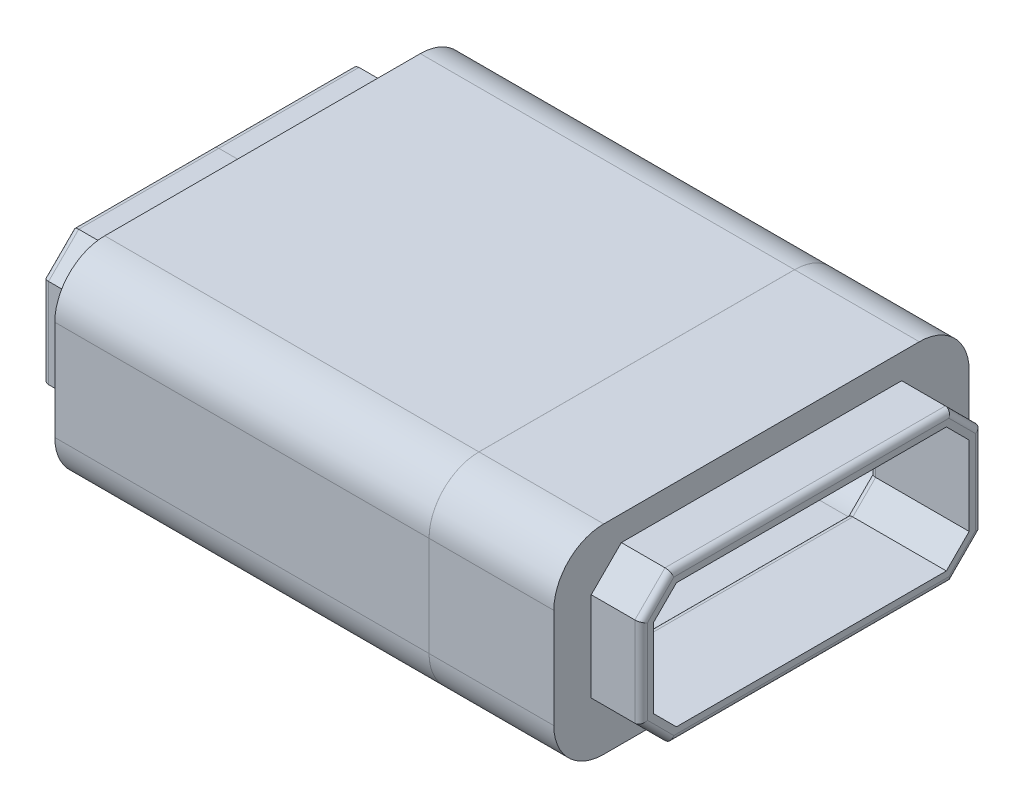
from build123d import *

# Parameters (mm, degrees)
CUT_EXTRUDE6_START   = -4
CUT_EXTRUDE6_DEPTH   = 4
BOSS_EXTRUDE11_DEPTH = 4
MIRROR2_START        = -4
MIRROR2_COPY_1_DEPTH = 4
MIRROR2_COPY_2_DEPTH = 4
FILLET6_R            = 0.5
BOSS_EXTRUDE14_START = -4
BOSS_EXTRUDE14_DEPTH = 4
BOSS_EXTRUDE15_DEPTH = 4
CUT_EXTRUDE9_START   = -4
CUT_EXTRUDE9_DEPTH   = 4
BOSS_EXTRUDE16_DEPTH = 8
MIRROR9_START        = -4
MIRROR9_COPY_1_DEPTH = 4
MIRROR9_COPY_2_DEPTH = 8
FILLET7_R            = 0.5


with BuildPart() as part:
    # Sweep1: sweep along a path in Sketch2path
    with BuildLine(Plane.XY) as sweep1_path:
        Line((40.002617842, -0.001745558), (30.002617994, -2.28e-07))
        ThreePointArc((30.002617994, -2.28e-07), (30.001308997, -5.7e-08), (30, 0))
        Line((30, 0), (0, 0))
    # Sketch3 → Sweep1 (sweep)
    with BuildSketch(Plane(origin=(0, 0, 0), x_dir=(0, 0, -1), z_dir=(1, 0, 0))):
        with BuildLine():
            Line((-16.65, -4), (-16.65, 4))
            ThreePointArc((-16.65, 4), (-15.478427125, 6.828427125), (-12.65, 8))
            Line((-12.65, 8), (12.65, 8))
            ThreePointArc((12.65, 8), (15.478427125, 6.828427125), (16.65, 4))
            Line((16.65, 4), (16.65, -4))
            ThreePointArc((16.65, -4), (15.478427125, -6.828427125), (12.65, -8))
            Line((12.65, -8), (-12.65, -8))
            ThreePointArc((-12.65, -8), (-15.478427125, -6.828427125), (-16.65, -4))
        make_face()
        with BuildLine():
            Line((-15.65, -4), (-15.65, 4))
            ThreePointArc((-15.65, 4), (-14.771320344, 6.121320344), (-12.65, 7))
            Line((-12.65, 7), (12.65, 7))
            ThreePointArc((12.65, 7), (14.771320344, 6.121320344), (15.65, 4))
            Line((15.65, 4), (15.65, -4))
            ThreePointArc((15.65, -4), (14.771320344, -6.121320344), (12.65, -7))
            Line((12.65, -7), (-12.65, -7))
            ThreePointArc((-12.65, -7), (-14.771320344, -6.121320344), (-15.65, -4))
        make_face(mode=Mode.SUBTRACT)
    sweep(path=sweep1_path.line)

    # Sweep3: sweep along a path in Sketch25
    with BuildLine(Plane.ZY) as sweep3_path:
        Line((11.65, 7), (-11.65, 7))
        ThreePointArc((-11.65, 7), (-13.771320344, 6.121320344), (-14.65, 4))
        Line((-14.65, 4), (-14.65, -4))
        ThreePointArc((-14.65, -4), (-13.771320344, -6.121320344), (-11.65, -7))
        Line((-11.65, -7), (11.65, -7))
        ThreePointArc((11.65, -7), (13.771320344, -6.121320344), (14.65, -4))
        Line((14.65, -4), (14.65, 4))
        ThreePointArc((14.65, 4), (13.771320344, 6.121320344), (11.65, 7))
    # Sketch24 → Sweep3 (sweep)
    with BuildSketch(Plane.XY):
        Polygon((0, 8), (4, 8), (4, 5), (-4, 5), (-4, 6), (0, 6), align=None)
    sweep(path=sweep3_path.line)

    # Sketch26 → Cut-Extrude6 (cut)
    with BuildSketch(Plane.ZY.offset(4).offset(CUT_EXTRUDE6_START)):
        with BuildLine():
            Line((-13.65, 3.585786438), (-11.235786438, 6))
            Line((-11.235786438, 6), (-11.65, 6))
            ThreePointArc((-11.65, 6), (-13.064213562, 5.414213562), (-13.65, 4))
            Line((-13.65, 4), (-13.65, 3.585786438))
        make_face()
    cut_extrude6 = extrude(amount=CUT_EXTRUDE6_DEPTH, mode=Mode.SUBTRACT)

    # Sketch27 → Boss-Extrude11 (add)
    with BuildSketch(Plane.ZY.offset(4)):
        Polygon((-13.65, 3.585786438), (-12.942893219, 2.878679656), (-10.821572875, 5), (-11.65, 5), (-11.65, 5.585786438), align=None)
        Polygon((-11.65, 5), (-10.821572875, 5), (-10.528679656, 5.292893219), (-11.235786438, 6), (-11.65, 5.585786438), align=None)
    boss_extrude11 = extrude(amount=-BOSS_EXTRUDE11_DEPTH)

    # Mirror1: Cut-Extrude6, Boss-Extrude11 across plane
    add(cut_extrude6.mirror(Plane.XY), mode=Mode.SUBTRACT)
    add(boss_extrude11.mirror(Plane.XY))

    # Mirror2: Cut-Extrude6, Boss-Extrude11 across plane
    add(cut_extrude6.mirror(Plane.ZX), mode=Mode.SUBTRACT)
    add(boss_extrude11.mirror(Plane.ZX))

    # Mirror2 copy 1 sketch → Mirror2 copy 1 (cut)
    with BuildSketch(Plane(origin=(-4, 0, 0), x_dir=(0, 0, -1), z_dir=(-1, 0, 0)).offset(MIRROR2_START)):
        with BuildLine():
            Line((-13.65, 3.585786438), (-11.235786438, 6))
            Line((-11.235786438, 6), (-11.65, 6))
            ThreePointArc((-11.65, 6), (-13.064213562, 5.414213562), (-13.65, 4))
            Line((-13.65, 4), (-13.65, 3.585786438))
        make_face()
    extrude(amount=MIRROR2_COPY_1_DEPTH, mode=Mode.SUBTRACT)

    # Mirror2 copy 2 sketch → Mirror2 copy 2 (add)
    with BuildSketch(Plane(origin=(-4, 0, 0), x_dir=(0, 0, -1), z_dir=(-1, 0, 0))):
        Polygon((-13.65, 3.585786438), (-12.942893219, 2.878679656), (-10.821572875, 5), (-11.65, 5), (-11.65, 5.585786438), align=None)
        Polygon((-11.65, 5), (-10.821572875, 5), (-10.528679656, 5.292893219), (-11.235786438, 6), (-11.65, 5.585786438), align=None)
    extrude(amount=-MIRROR2_COPY_2_DEPTH)

    # Fillet6
    fillet6_edges = [part.edges().sort_by_distance(p)[0] for p in [
        (4, -6.121320344, 14.771320344),
        (4, -7, 0),
        (4, -7, 0),
        (4, 6.121320344, -14.771320344),
        (4, 7, 0),
        (4, 7, 0),
        (4, 7, 0),
        (4, 6.121320344, 14.771320344),
        (4, -6.121320344, -14.771320344),
        (4, 5, 0),
        (4, 4.707106781, -12.357106781),
        (4, 7, 0),
        (4, 0, -12.65),
        (4, 0, -15.65),
        (4, -4.707106781, -12.357106781),
        (4, -5, 0),
        (4, -4.707106781, 12.357106781),
        (4, -7, 0),
        (4, 0, 12.65),
        (4, 0, 15.65),
        (4, 4.707106781, 12.357106781),
        (4, 5, 0),
        (-4, 6, 0),
        (-4, 4.792893219, -12.442893219),
        (-4, 6, 0),
        (-4, 0, 13.65),
        (-4, 4.792893219, 12.442893219),
        (-4, -4.792893219, 12.442893219),
        (-4, -6, 0),
        (-4, -4.792893219, -12.442893219),
        (-4, 0, -13.65),
    ]]
    fillet(fillet6_edges, radius=FILLET6_R)

    # Sketch36 → Boss-Extrude14 (add)
    with BuildSketch(Plane(origin=(40.002616928, -0.006981774, 0), x_dir=(0, 0, -1), z_dir=(0.9999999847691291, -0.00017453292431325135, 0)).offset(BOSS_EXTRUDE14_START)):
        with BuildLine():
            Line((-15.65, 4.005236216), (-15.65, -3.994763784))
            ThreePointArc((-15.65, -3.994763784), (-14.771320344, -6.116084127), (-12.65, -6.994763784))
            Line((-12.65, -6.994763784), (12.65, -6.994763784))
            ThreePointArc((12.65, -6.994763784), (14.771320344, -6.116084127), (15.65, -3.994763784))
            Line((15.65, -3.994763784), (15.65, 4.005236216))
            ThreePointArc((15.65, 4.005236216), (14.771320344, 6.12655656), (12.65, 7.005236216))
            Line((12.65, 7.005236216), (-12.65, 7.005236216))
            ThreePointArc((-12.65, 7.005236216), (-14.771320344, 6.12655656), (-15.65, 4.005236216))
        make_face()
        with BuildLine():
            Line((-11.65, -4.994763784), (11.65, -4.994763784))
            ThreePointArc((11.65, -4.994763784), (12.357106781, -4.701870565), (12.65, -3.994763784))
            Line((12.65, -3.994763784), (12.65, 4.005236216))
            ThreePointArc((12.65, 4.005236216), (12.357106781, 4.712342997), (11.65, 5.005236216))
            Line((11.65, 5.005236216), (-11.65, 5.005236216))
            ThreePointArc((-11.65, 5.005236216), (-12.357106781, 4.712342997), (-12.65, 4.005236216))
            Line((-12.65, 4.005236216), (-12.65, -3.994763784))
            ThreePointArc((-12.65, -3.994763784), (-12.357106781, -4.701870565), (-11.65, -4.994763784))
        make_face(mode=Mode.SUBTRACT)
    extrude(amount=BOSS_EXTRUDE14_DEPTH)

    # Sketch37 → Boss-Extrude15 (add)
    with BuildSketch(Plane(origin=(40.002616928, -0.006981774, 0), x_dir=(0, 0, -1), z_dir=(0.9999999847691291, -0.00017453292431325135, 0))):
        with BuildLine():
            Line((11.65, 6.005236216), (-11.65, 6.005236216))
            ThreePointArc((-11.65, 6.005236216), (-13.064213562, 5.419449779), (-13.65, 4.005236216))
            Line((-13.65, 4.005236216), (-13.65, -3.994763784))
            ThreePointArc((-13.65, -3.994763784), (-13.064213562, -5.408977346), (-11.65, -5.994763784))
            Line((-11.65, -5.994763784), (11.65, -5.994763784))
            ThreePointArc((11.65, -5.994763784), (13.064213562, -5.408977346), (13.65, -3.994763784))
            Line((13.65, -3.994763784), (13.65, 4.005236216))
            ThreePointArc((13.65, 4.005236216), (13.064213562, 5.419449779), (11.65, 6.005236216))
        make_face()
        with BuildLine():
            Line((12.65, -3.994763784), (12.65, 4.005236216))
            ThreePointArc((12.65, 4.005236216), (12.357106781, 4.712342997), (11.65, 5.005236216))
            Line((11.65, 5.005236216), (-11.65, 5.005236216))
            ThreePointArc((-11.65, 5.005236216), (-12.357106781, 4.712342997), (-12.65, 4.005236216))
            Line((-12.65, 4.005236216), (-12.65, -3.994763784))
            ThreePointArc((-12.65, -3.994763784), (-12.357106781, -4.701870565), (-11.65, -4.994763784))
            Line((-11.65, -4.994763784), (11.65, -4.994763784))
            ThreePointArc((11.65, -4.994763784), (12.357106781, -4.701870565), (12.65, -3.994763784))
        make_face(mode=Mode.SUBTRACT)
    extrude(amount=BOSS_EXTRUDE15_DEPTH)

    # Sketch38 → Cut-Extrude9 (cut)
    with BuildSketch(Plane(origin=(44.002616867, -0.007679906, 0), x_dir=(0, 0, -1), z_dir=(0.9999999847691291, -0.00017453292431325137, 0)).offset(CUT_EXTRUDE9_START)):
        with BuildLine():
            Line((-13.65, 4.005236216), (-13.65, 3.591022654))
            Line((-13.65, 3.591022654), (-11.235786438, 6.005236216))
            Line((-11.235786438, 6.005236216), (-11.65, 6.005236216))
            ThreePointArc((-11.65, 6.005236216), (-13.064213562, 5.419449779), (-13.65, 4.005236216))
        make_face()
        with BuildLine():
            Line((-11.942893219, 6.298129435), (-13.942893219, 6.298129435))
            Line((-13.942893219, 6.298129435), (-13.942893219, 3.298129435))
            Line((-13.942893219, 3.298129435), (-13.65, 3.591022654))
            Line((-13.65, 3.591022654), (-13.65, 4.005236216))
            ThreePointArc((-13.65, 4.005236216), (-13.064213562, 5.419449779), (-11.65, 6.005236216))
            Line((-11.65, 6.005236216), (-11.235786438, 6.005236216))
            Line((-11.235786438, 6.005236216), (-10.942893219, 6.298129435))
            Line((-10.942893219, 6.298129435), (-11.942893219, 6.298129435))
        make_face()
    cut_extrude9 = extrude(amount=CUT_EXTRUDE9_DEPTH, mode=Mode.SUBTRACT)

    # Sketch39 → Boss-Extrude16 (add)
    with BuildSketch(Plane(origin=(44.002616867, -0.007679906, 0), x_dir=(0, 0, -1), z_dir=(0.9999999847691291, -0.00017453292431325137, 0))):
        Polygon((-12.942893219, 2.883915873), (-10.528679656, 5.298129435), (-11.235786438, 6.005236216), (-13.65, 3.591022654), align=None)
    boss_extrude16 = extrude(amount=-BOSS_EXTRUDE16_DEPTH)

    # Mirror7: Cut-Extrude9, Boss-Extrude16 across plane
    add(cut_extrude9.mirror(Plane.XY), mode=Mode.SUBTRACT)
    add(boss_extrude16.mirror(Plane.XY))

    # Mirror9: Cut-Extrude9, Boss-Extrude16 across plane
    add(cut_extrude9.mirror(Plane(origin=(9.14e-07, 0.005236216, 0), x_dir=(0, 0, 1), z_dir=(0.0001745329243132514, 0.9999999847691291, 0))), mode=Mode.SUBTRACT)
    add(boss_extrude16.mirror(Plane(origin=(9.14e-07, 0.005236216, 0), x_dir=(0, 0, 1), z_dir=(0.0001745329243132514, 0.9999999847691291, 0))))

    # Mirror9 copy 1 sketch → Mirror9 copy 1 (cut)
    with BuildSketch(Plane(origin=(44.002618695, 0.002792527, 0), x_dir=(0, 0, 1), z_dir=(0.999999984769129, -0.00017453292431325146, 0)).offset(MIRROR9_START)):
        with BuildLine():
            Line((-13.65, 4.005236216), (-13.65, 3.591022654))
            Line((-13.65, 3.591022654), (-11.235786438, 6.005236216))
            Line((-11.235786438, 6.005236216), (-11.65, 6.005236216))
            ThreePointArc((-11.65, 6.005236216), (-13.064213562, 5.419449779), (-13.65, 4.005236216))
        make_face()
        with BuildLine():
            Line((-11.942893219, 6.298129435), (-13.942893219, 6.298129435))
            Line((-13.942893219, 6.298129435), (-13.942893219, 3.298129435))
            Line((-13.942893219, 3.298129435), (-13.65, 3.591022654))
            Line((-13.65, 3.591022654), (-13.65, 4.005236216))
            ThreePointArc((-13.65, 4.005236216), (-13.064213562, 5.419449779), (-11.65, 6.005236216))
            Line((-11.65, 6.005236216), (-11.235786438, 6.005236216))
            Line((-11.235786438, 6.005236216), (-10.942893219, 6.298129435))
            Line((-10.942893219, 6.298129435), (-11.942893219, 6.298129435))
        make_face()
    extrude(amount=MIRROR9_COPY_1_DEPTH, mode=Mode.SUBTRACT)

    # Mirror9 copy 2 sketch → Mirror9 copy 2 (add)
    with BuildSketch(Plane(origin=(44.002618695, 0.002792527, 0), x_dir=(0, 0, 1), z_dir=(0.999999984769129, -0.00017453292431325146, 0))):
        Polygon((-12.942893219, 2.883915873), (-10.528679656, 5.298129435), (-11.235786438, 6.005236216), (-13.65, 3.591022654), align=None)
    extrude(amount=-MIRROR9_COPY_2_DEPTH)

    # Fillet7
    fillet7_edges = [part.edges().sort_by_distance(p)[0] for p in [
        (36.003686274, 6.120272824, 14.771320344),
        (36.003839633, 6.998952467, 0),
        (36.003686274, 6.120272824, -14.771320344),
        (36.002617902, -0.001047426, -15.65),
        (36.001549531, -6.122367676, -14.771320344),
        (36.001396172, -7.001047319, 0),
        (36.001549531, -6.122367676, 14.771320344),
        (36.002617902, -0.001047426, 15.65),
        (44.002617781, -0.002443689, 13.65),
        (44.003454298, 4.790449456, 12.442893219),
        (36.002617902, -0.001047426, 12.65),
        (36.003331007, 4.084738949, 11.735786438),
        (44.003664978, 5.997556219, 0),
        (44.003454298, 4.790449456, -12.442893219),
        (36.003490567, 4.998952498, 0),
        (36.003331007, 4.084738949, -11.735786438),
        (44.002617781, -0.002443689, -13.65),
        (44.001781263, -4.795336835, -12.442893219),
        (36.002617902, -0.001047426, -12.65),
        (36.001904798, -4.086833801, -11.735786438),
        (44.001570583, -6.002443598, 0),
        (44.001781263, -4.795336835, 12.442893219),
        (36.001745238, -5.00104735, 0),
        (36.001904798, -4.086833801, 11.735786438),
    ]]
    fillet(fillet7_edges, radius=FILLET7_R)


solid = part.part
